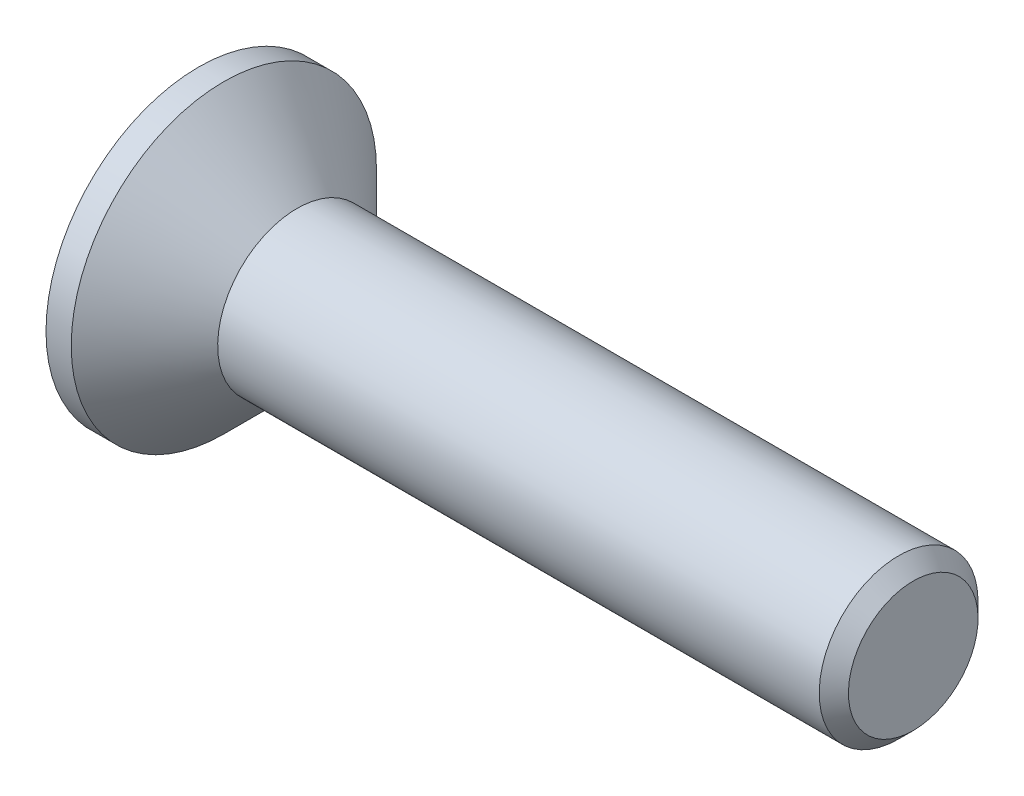
from build123d import *

# Parameters (mm, degrees)
EXTRUDE_462_REACH = 49.007
CHAMFER_1_SIZE    = 0.920175


with BuildPart() as part:
    # 草圖1 → Revolve 332 (revolve)
    with BuildSketch(Plane.XY, mode=Mode.PRIVATE) as revolve_332_sk:
        Polygon((45, 0), (45, 5), (13, 5), (12.079825, 5), (6.2, 5), (1.59, 9.61), (0, 9.61), (0, 3.464101615), (4.18, 3.464101615), (6.18, 0), align=None)
    revolve(revolve_332_sk.sketch.rotate(Axis((6.18, 0, 0), (1, 0, 0)), 180), axis=Axis((6.18, 0, 0), (1, 0, 0)))

    # 草圖2 → Extrude 462 (add, up to next)
    with BuildSketch(Plane.ZY, mode=Mode.PRIVATE) as extrude_462_sk1:
        with BuildLine():
            ThreePointArc((0, 3.464101615), (-2.449489743, -2.449489743), (3.464101615, 0))
            ThreePointArc((3.464101615, 0), (2.449489743, 2.449489743), (0, 3.464101615))
        make_face()
    extrude_462_tool1 = extrude(extrude_462_sk1.sketch, amount=-EXTRUDE_462_REACH, mode=Mode.PRIVATE) - part.part
    add(extrude_462_tool1.solids().sort_by_distance((0, 0, 0))[0])

    # 倒角1
    chamfer_1_edges = [part.edges().sort_by_distance(p)[0] for p in [
        (45, 5, 0),
    ]]
    chamfer(chamfer_1_edges, length=CHAMFER_1_SIZE)


solid = part.part
